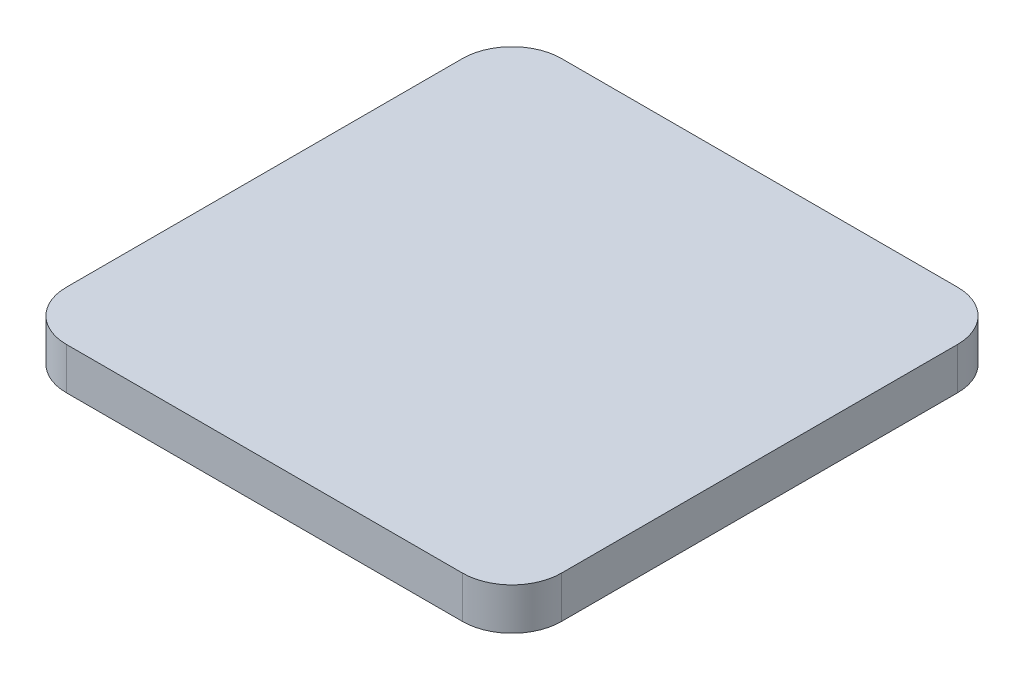
from build123d import *

# Parameters (mm, degrees)
SKETCH1_W           = 30
SKETCH1_H           = 30
BOSS_EXTRUDE1_DEPTH = 2.54
FILLET1_R           = 3


with BuildPart() as part:
    # Sketch1 → Boss-Extrude1 (new body)
    with BuildSketch(Plane(origin=(0, 0, 0), x_dir=(1, 0, 0), z_dir=(0, 1, 0))):
        Rectangle(SKETCH1_W, SKETCH1_H)
    extrude(amount=BOSS_EXTRUDE1_DEPTH)

    # Fillet1
    fillet1_edges = [part.edges().sort_by_distance(p)[0] for p in [
        (-15, 1.27, -15),
        (-15, 1.27, 15),
        (15, 1.27, -15),
        (15, 1.27, 15),
    ]]
    fillet(fillet1_edges, radius=FILLET1_R)


solid = part.part
